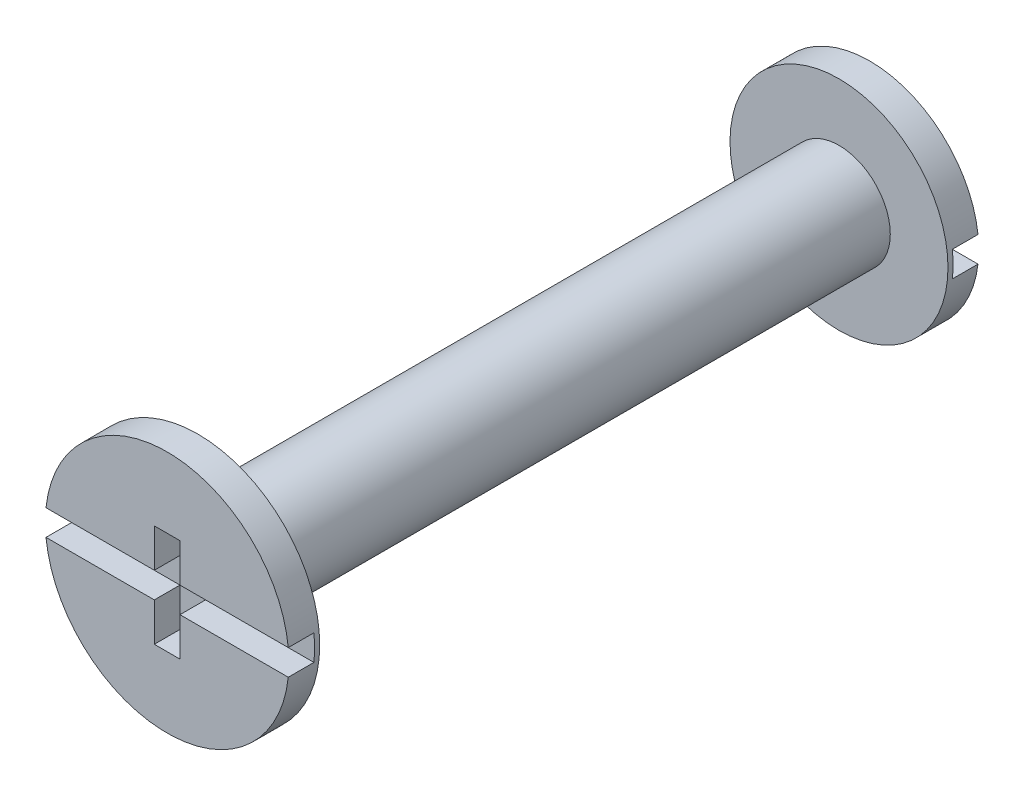
from build123d import *

# Parameters (mm, degrees)
SKETCH_1_R          = 4.25
EXTRUDE_1_DEPTH     = 1.2
SKETCH_2_R          = 2
EXTRUDE_2_DEPTH     = 25
SKETCH_3_R          = 4.75
EXTRUDE_3_DEPTH     = 1.2
CUT_EXTRUDE_START   = -1
CUT_EXTRUDE_1_DEPTH = 1
CUT_EXTRUDE_2_DEPTH = 1


with BuildPart() as part:
    # 草图1 → 凸台-拉伸1 (new body)
    with BuildSketch(Plane.XY):
        Circle(SKETCH_1_R)
    extrude(amount=EXTRUDE_1_DEPTH)

    # 草图2 → 凸台-拉伸2 (add)
    with BuildSketch(Plane.XY.offset(1.2)):
        Circle(SKETCH_2_R)
    extrude(amount=EXTRUDE_2_DEPTH)

    # 草图3 → 凸台-拉伸3 (add)
    with BuildSketch(Plane.XY.offset(26.2)):
        Circle(SKETCH_3_R)
    extrude(amount=EXTRUDE_3_DEPTH)

    # 草图4 → 切除-拉伸1 (cut)
    with BuildSketch(Plane.XY.offset(27.4).offset(CUT_EXTRUDE_START)):
        with BuildLine():
            Line((-0.5, 2), (-0.5, 0.5))
            Line((-0.5, 0.5), (-4.723610907, 0.5))
            ThreePointArc((-4.723610907, 0.5), (-4.75, 0), (-4.723610907, -0.5))
            Line((-4.723610907, -0.5), (-0.5, -0.5))
            Line((-0.5, -0.5), (-0.5, -2))
            Line((-0.5, -2), (0.5, -2))
            Line((0.5, -2), (0.5, -0.5))
            Line((0.5, -0.5), (4.723610907, -0.5))
            ThreePointArc((4.723610907, -0.5), (4.75, 0), (4.723610907, 0.5))
            Line((4.723610907, 0.5), (0.5, 0.5))
            Line((0.5, 0.5), (0.5, 2))
            Line((0.5, 2), (-0.5, 2))
        make_face()
    extrude(amount=CUT_EXTRUDE_1_DEPTH, mode=Mode.SUBTRACT)

    # 草图5 → 切除-拉伸2 (cut)
    with BuildSketch(Plane(origin=(0, 0, 0), x_dir=(-1, 0, 0), z_dir=(0, 0, -1))):
        with BuildLine():
            Line((-4.723610907, -0.5), (4.723610907, -0.5))
            ThreePointArc((4.723610907, -0.5), (4.75, 0), (4.723610907, 0.5))
            Line((4.723610907, 0.5), (-4.723610907, 0.5))
            ThreePointArc((-4.723610907, 0.5), (-4.75, 0), (-4.723610907, -0.5))
        make_face()
    extrude(amount=-CUT_EXTRUDE_2_DEPTH, mode=Mode.SUBTRACT)


solid = part.part
